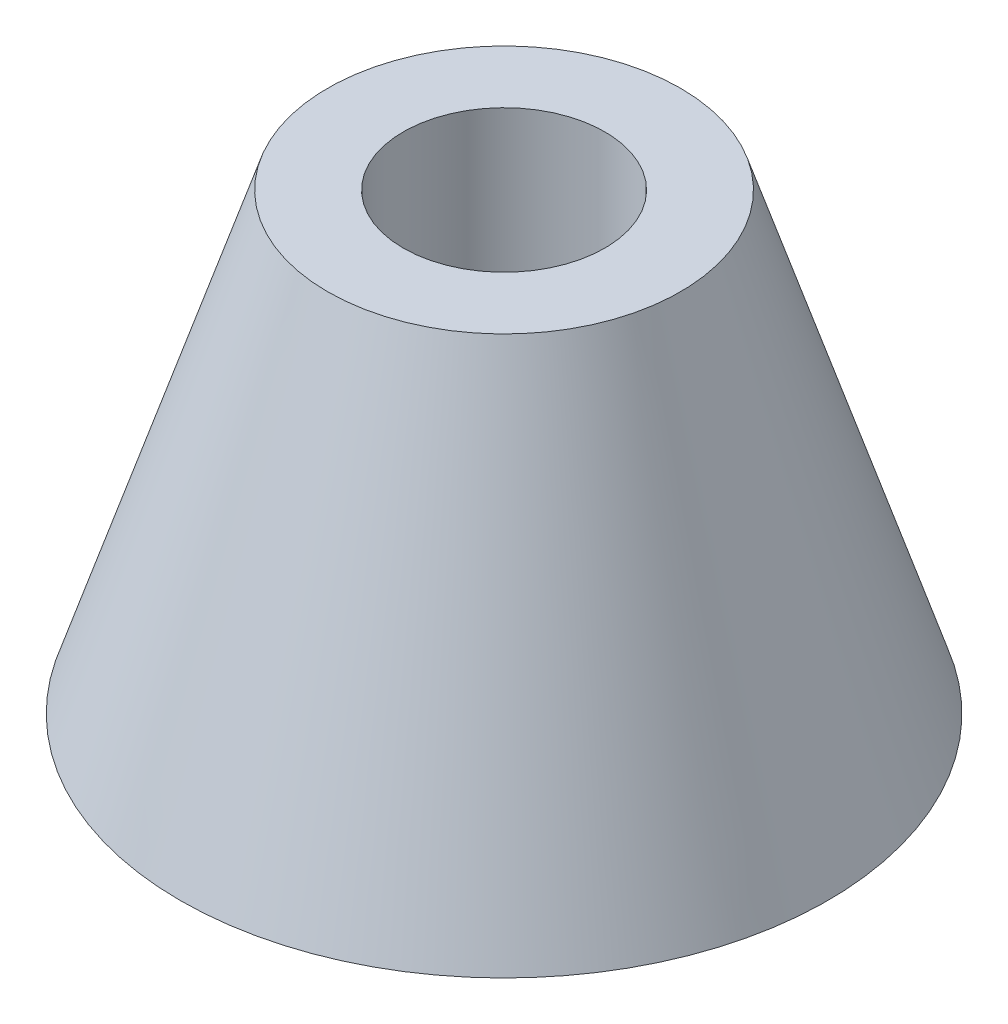
from build123d import *

# Parameters (mm, degrees)
SKETCH1_R      = 3.5
SKETCH1_R_2    = 2
EXTRUDE1_DEPTH = 9
DRAFT7_ANGLE   = 18


with BuildPart() as part:
    # Sketch1 → Extrude1 (new body)
    with BuildSketch(Plane(origin=(0, 0, 0), x_dir=(1, 0, 0), z_dir=(0, 1, 0))):
        with Locations(Location((0, 0, 0), (0, 0, 270))):
            Circle(SKETCH1_R)
        with Locations(Location((0, 0, 0), (0, 0, 270))):
            Circle(SKETCH1_R_2, mode=Mode.SUBTRACT)
    extrude(amount=EXTRUDE1_DEPTH)

    # Draft7
    draft7_faces = [part.faces().sort_by_distance(p)[0] for p in [
        (0, 4.5, -3.5),
    ]]
    draft(draft7_faces, Plane.ZX.offset(9), DRAFT7_ANGLE)


solid = part.part
